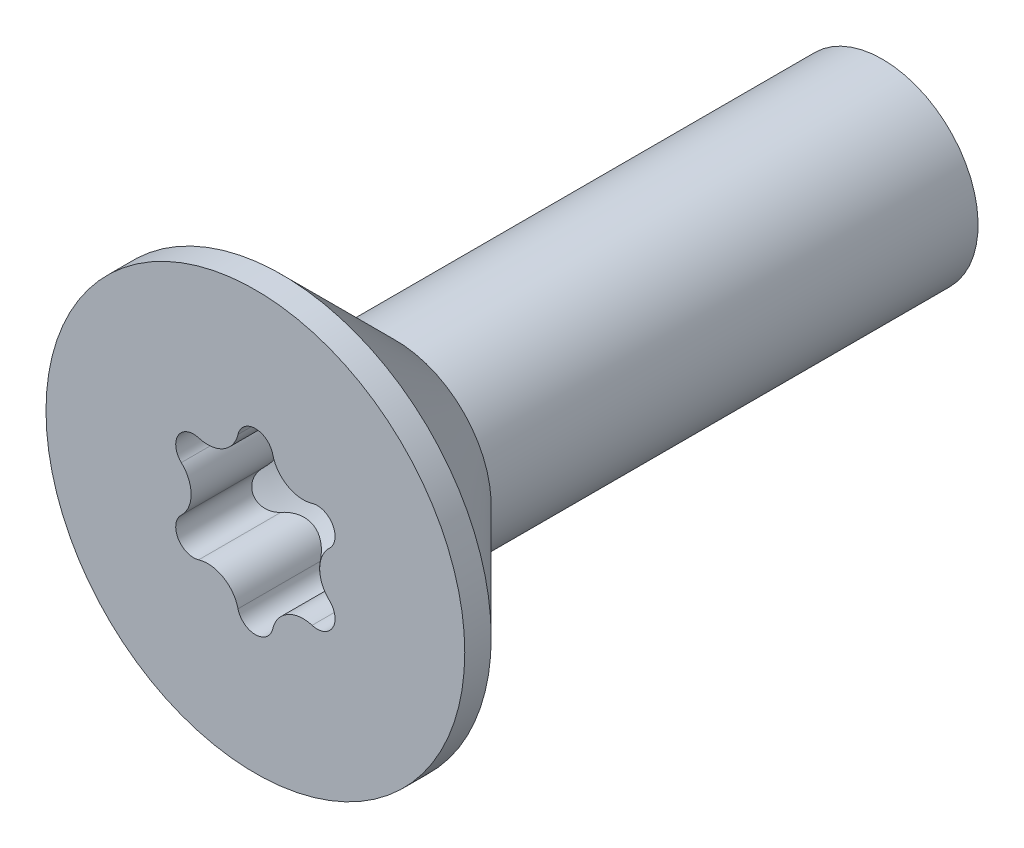
from build123d import *

# Parameters (mm, degrees)
HEXALOBULAR_REACH = 13.026


with BuildPart() as part:
    # BodySke → Base-Revolve (revolve)
    with BuildSketch(Plane(origin=(0, 0, 0), x_dir=(0, 0, -1), z_dir=(1, 0, 0)), mode=Mode.PRIVATE) as base_revolve_sk:
        Polygon((0, 0), (0, 3.285), (0.415, 3.285), (2.2, 1.5), (10, 1.5), (10, 0), align=None)
    revolve(base_revolve_sk.sketch.rotate(Axis((0, 0, 0), (0, 0, 1)), 90), axis=Axis((0, 0, 0), (0, 0, 1)))

    # PreBSke → PreBroach (revolve, cut)
    with BuildSketch(Plane(origin=(0, 0, 0), x_dir=(0, 0, -1), z_dir=(1, 0, 0)), mode=Mode.PRIVATE) as prebroach_sk:
        Polygon((0, 0), (0, 1.4), (1.18, 1.4), (2.021204867, 0), align=None)
    revolve(prebroach_sk.sketch.rotate(Axis((0, 0, 0), (0, 0, 1)), 90), axis=Axis((0, 0, 0), (0, 0, 1)), mode=Mode.SUBTRACT)

    # Hexalobular: up to this cone (the profile starts inside it)
    hexalobular_end = Plane(origin=(0, 0, 0), z_dir=(0, 0, 1)).offset(-2.021203867) * Cone(1.664e-06, 31.473280253, 18.911053656, align=(Align.CENTER, Align.CENTER, Align.MIN), mode=Mode.PRIVATE)
    # HexSke → Hexalobular (add, up to the surface)
    with BuildSketch(Plane.XY, mode=Mode.PRIVATE) as hexalobular_sk1:
        with BuildLine():
            ThreePointArc((-1.212435565, -0.7), (-1.246995094, -0.519439448), (-1.162126056, -0.356363636))
            ThreePointArc((-1.162126056, -0.356363636), (-1.008436863, 0), (-1.162126056, 0.356363636))
            ThreePointArc((-1.162126056, 0.356363636), (-1.246995094, 0.519439448), (-1.212435565, 0.7))
            ThreePointArc((-1.212435565, 0.7), (-1.4, 0), (-1.212435565, -0.7))
        make_face()
    hexalobular_tool1 = extrude(hexalobular_sk1.sketch, amount=-HEXALOBULAR_REACH, mode=Mode.PRIVATE) & hexalobular_end
    add(hexalobular_tool1.solids().sort_by_distance((-1.225792, 0, 0))[0])
    # HexSke → Hexalobular (add, up to the surface)
    with BuildSketch(Plane.XY, mode=Mode.PRIVATE) as hexalobular_sk2:
        with BuildLine():
            ThreePointArc((0, 1.4), (-0.7, 1.212435565), (-1.212435565, 0.7))
            ThreePointArc((-1.212435565, 0.7), (-1.073345305, 0.820209706), (-0.88968299, 0.828248869))
            ThreePointArc((-0.88968299, 0.828248869), (-0.504218431, 0.873331941), (-0.272443066, 1.184612505))
            ThreePointArc((-0.272443066, 1.184612505), (-0.173649789, 1.339649154), (0, 1.4))
        make_face()
    hexalobular_tool2 = extrude(hexalobular_sk2.sketch, amount=-HEXALOBULAR_REACH, mode=Mode.PRIVATE) & hexalobular_end
    add(hexalobular_tool2.solids().sort_by_distance((-0.612896, 1.061567, 0))[0])
    # HexSke → Hexalobular (add, up to the surface)
    with BuildSketch(Plane.XY, mode=Mode.PRIVATE) as hexalobular_sk3:
        with BuildLine():
            ThreePointArc((1.212435565, 0.7), (0.7, 1.212435565), (0, 1.4))
            ThreePointArc((0, 1.4), (0.173649789, 1.339649154), (0.272443066, 1.184612505))
            ThreePointArc((0.272443066, 1.184612505), (0.504218431, 0.873331941), (0.88968299, 0.828248869))
            ThreePointArc((0.88968299, 0.828248869), (1.073345305, 0.820209706), (1.212435565, 0.7))
        make_face()
    hexalobular_tool3 = extrude(hexalobular_sk3.sketch, amount=-HEXALOBULAR_REACH, mode=Mode.PRIVATE) & hexalobular_end
    add(hexalobular_tool3.solids().sort_by_distance((0.612896, 1.061567, 0))[0])
    # HexSke → Hexalobular (add, up to the surface)
    with BuildSketch(Plane.XY, mode=Mode.PRIVATE) as hexalobular_sk4:
        with BuildLine():
            ThreePointArc((1.162126056, -0.356363636), (1.246995094, -0.519439448), (1.212435565, -0.7))
            ThreePointArc((1.212435565, -0.7), (1.352296157, -0.362346663), (1.4, 0))
            ThreePointArc((1.4, 0), (1.352296157, 0.362346663), (1.212435565, 0.7))
            ThreePointArc((1.212435565, 0.7), (1.246995094, 0.519439448), (1.162126056, 0.356363636))
            ThreePointArc((1.162126056, 0.356363636), (1.008436863, 0), (1.162126056, -0.356363636))
        make_face()
    hexalobular_tool4 = extrude(hexalobular_sk4.sketch, amount=-HEXALOBULAR_REACH, mode=Mode.PRIVATE) & hexalobular_end
    add(hexalobular_tool4.solids().sort_by_distance((1.225792, 0, 0))[0])
    # HexSke → Hexalobular (add, up to the surface)
    with BuildSketch(Plane.XY, mode=Mode.PRIVATE) as hexalobular_sk5:
        with BuildLine():
            ThreePointArc((0.272443066, -1.184612505), (0.173649789, -1.339649154), (0, -1.4))
            ThreePointArc((0, -1.4), (0.7, -1.212435565), (1.212435565, -0.7))
            ThreePointArc((1.212435565, -0.7), (1.073345305, -0.820209706), (0.88968299, -0.828248869))
            ThreePointArc((0.88968299, -0.828248869), (0.504218431, -0.873331941), (0.272443066, -1.184612505))
        make_face()
    hexalobular_tool5 = extrude(hexalobular_sk5.sketch, amount=-HEXALOBULAR_REACH, mode=Mode.PRIVATE) & hexalobular_end
    add(hexalobular_tool5.solids().sort_by_distance((0.612896, -1.061567, 0))[0])
    # HexSke → Hexalobular (add, up to the surface)
    with BuildSketch(Plane.XY, mode=Mode.PRIVATE) as hexalobular_sk6:
        with BuildLine():
            ThreePointArc((-0.88968299, -0.828248869), (-1.073345305, -0.820209706), (-1.212435565, -0.7))
            ThreePointArc((-1.212435565, -0.7), (-0.7, -1.212435565), (0, -1.4))
            ThreePointArc((0, -1.4), (-0.173649789, -1.339649154), (-0.272443066, -1.184612505))
            ThreePointArc((-0.272443066, -1.184612505), (-0.504218431, -0.873331941), (-0.88968299, -0.828248869))
        make_face()
    hexalobular_tool6 = extrude(hexalobular_sk6.sketch, amount=-HEXALOBULAR_REACH, mode=Mode.PRIVATE) & hexalobular_end
    add(hexalobular_tool6.solids().sort_by_distance((-0.612896, -1.061567, 0))[0])

    # ThdSchSke → ThreadSchematic (revolve, cut)
    with BuildSketch(Plane(origin=(0, 0, 0), x_dir=(0, 0, -1), z_dir=(1, 0, 0))):
        Polygon((10.161946751, 1.5), (10, 1.2195), (9.838053249, 1.5), align=None)
    revolve(axis=Axis((0, 0, 0), (0, 0, 1)), mode=Mode.SUBTRACT)


solid = part.part
